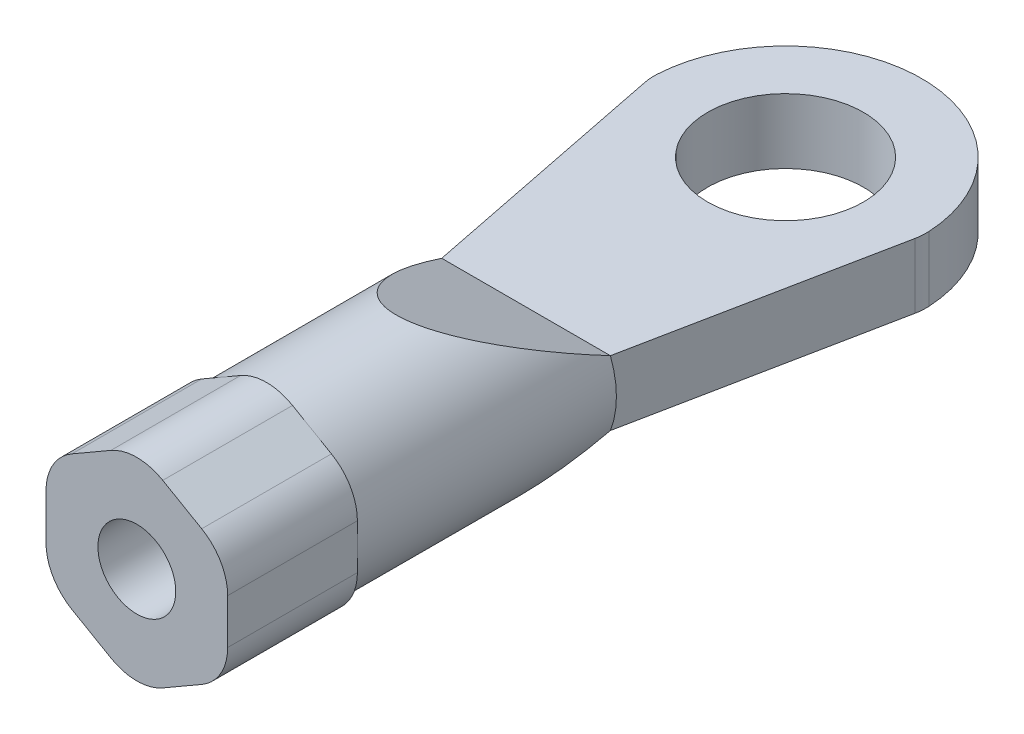
from build123d import *

# Parameters (mm, degrees)
EXTRUDE_1_DEPTH          = 2.5
SKETCH_2_R               = 3
CUT_EXTRUDE_1_DEPTH      = 2.5
FILLET_1_R               = 2
SKETCH_3_R               = 3.482097069
EXTRUDE_2_DEPTH          = 15
CUT_EXTRUDE_2_DEPTH      = 15
CUT_EXTRUDE_2_DEPTH_BACK = 15
SKETCH_6_R               = 1.5
CUT_EXTRUDE_3_DEPTH      = 10
EXTRUDE_3_DEPTH          = 5
SKETCH_8_R               = 1.5
CUT_EXTRUDE_4_DEPTH      = 5
FILLET_2_R               = 2


with BuildPart() as part:
    # 草图1 → 凸台-拉伸1 (new body)
    with BuildSketch(Plane(origin=(0, 0, 0), x_dir=(1, 0, 0), z_dir=(0, 1, 0))):
        with BuildLine():
            ThreePointArc((5.25, 0), (0, 5.25), (-5.25, 0))
            Line((-5.25, 0), (-3.25, -10))
            Line((-3.25, -10), (3.25, -10))
            Line((3.25, -10), (5.25, 0))
        make_face()
    extrude(amount=EXTRUDE_1_DEPTH)

    # 草图2 → 切除-拉伸1 (cut)
    with BuildSketch(Plane(origin=(0, 2.5, 0), x_dir=(1, 0, 0), z_dir=(0, 1, 0))):
        Circle(SKETCH_2_R)
    extrude(amount=-CUT_EXTRUDE_1_DEPTH, mode=Mode.SUBTRACT)

    # 圆角1
    fillet_1_edges = [part.edges().sort_by_distance(p)[0] for p in [
        (-5.25, 1.25, 0),
        (5.25, 1.25, 0),
    ]]
    fillet(fillet_1_edges, radius=FILLET_1_R)

    # 草图3 → 凸台-拉伸2 (add)
    with BuildSketch(Plane.XY.offset(10)):
        with Locations((0, 1.25)):
            Circle(SKETCH_3_R)
    extrude(amount=EXTRUDE_2_DEPTH)

    # 草图5 → 切除-拉伸2 (cut, two sides: drawn at the far end of the back side and taken through both)
    with BuildSketch(Plane(origin=(0, 0, 0), x_dir=(0, 0, -1), z_dir=(1, 0, 0)).offset(-CUT_EXTRUDE_2_DEPTH_BACK)):
        Polygon((-10, 2.5), (-15, 4.732097069), (-10, 4.732097069), align=None)
        Polygon((-10, 0), (-15, -2.232097069), (-10, -2.232097069), align=None)
    extrude(amount=CUT_EXTRUDE_2_DEPTH + CUT_EXTRUDE_2_DEPTH_BACK, mode=Mode.SUBTRACT)

    # 草图6 → 切除-拉伸3 (cut)
    with BuildSketch(Plane.XY.offset(25)):
        with Locations((0, 1.25)):
            Circle(SKETCH_6_R)
    extrude(amount=-CUT_EXTRUDE_3_DEPTH, mode=Mode.SUBTRACT)

    # 草图7 → 凸台-拉伸3 (add)
    with BuildSketch(Plane.XY.offset(25)):
        Polygon((0, 5.291451884), (-3.5, 3.270725942), (-3.5, -0.770725942), (0, -2.791451884), (3.5, -0.770725942), (3.5, 3.270725942), align=None)
    extrude(amount=-EXTRUDE_3_DEPTH)

    # 草图8 → 切除-拉伸4 (cut)
    with BuildSketch(Plane.XY.offset(25)):
        with Locations((0, 1.25)):
            Circle(SKETCH_8_R)
    extrude(amount=-CUT_EXTRUDE_4_DEPTH, mode=Mode.SUBTRACT)

    # 圆角2
    fillet_2_edges = [part.edges().sort_by_distance(p)[0] for p in [
        (0, -2.791451884, 22.5),
        (3.5, -0.770725942, 22.5),
        (-3.5, -0.770725942, 22.5),
        (-3.5, 3.270725942, 22.5),
        (0, 5.291451884, 22.5),
        (3.5, 3.270725942, 22.5),
    ]]
    fillet(fillet_2_edges, radius=FILLET_2_R)


solid = part.part
